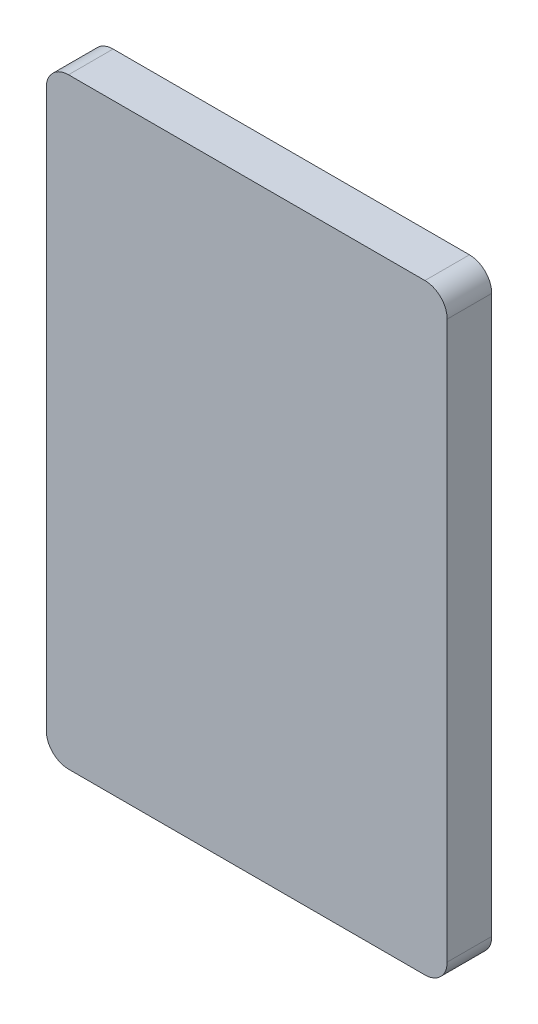
from build123d import *

# Parameters (mm, degrees)
SKETCH1_W  = 18
SKETCH1_H  = 27
BASE_DEPTH = 2
FILLET_2_R = 1


with BuildPart() as part:
    # Sketch1 → Base (new body)
    with BuildSketch(Plane.XY):
        Rectangle(SKETCH1_W, SKETCH1_H)
    extrude(amount=BASE_DEPTH)

    # Fillet 2
    fillet_2_edges = [part.edges().sort_by_distance(p)[0] for p in [
        (-9, 13.5, 1),
        (9, 13.5, 1),
        (9, -13.5, 1),
        (-9, -13.5, 1),
    ]]
    fillet(fillet_2_edges, radius=FILLET_2_R)


solid = part.part
